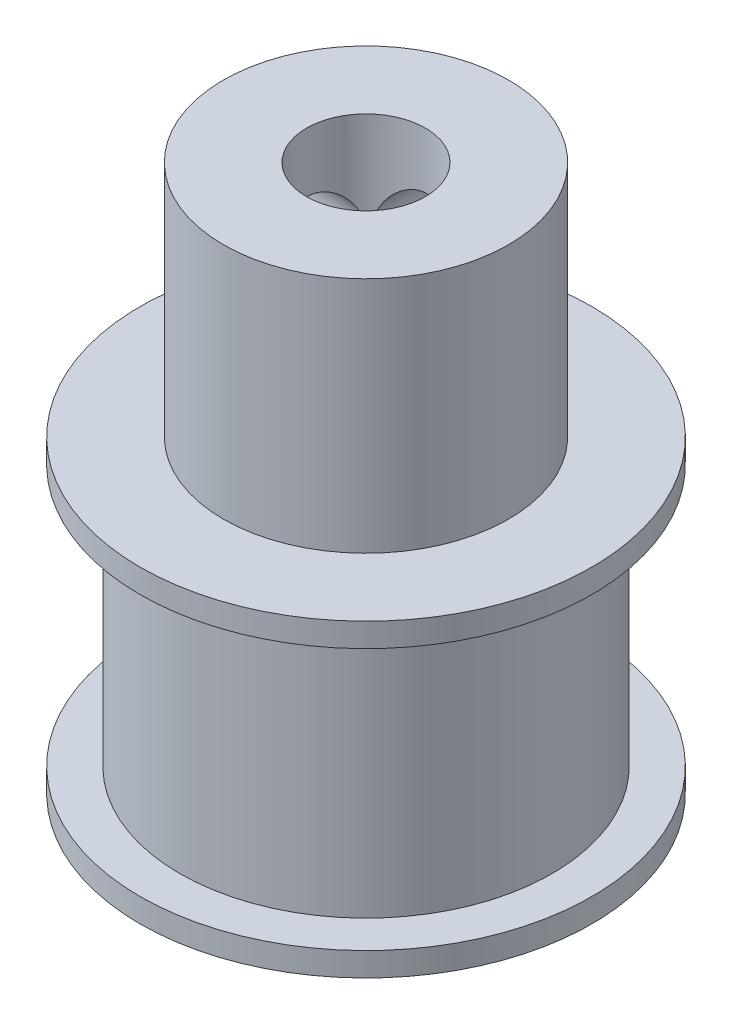
from build123d import *

# Parameters (mm, degrees)
SKETCH_1_R              = 9.5
EXTRUDE_1_DEPTH         = 1
SKETCH_2_R              = 7.83
EXTRUDE_2_DEPTH         = 11
SKETCH_3_R              = 9.5
EXTRUDE_3_DEPTH         = 1
SKETCH_4_R              = 6
EXTRUDE_4_DEPTH         = 10
SKETCH_5_R              = 2.5
CUT_EXTRUDE_1_DEPTH     = 27.636441204
HOLE_WIZARD_M4_1_REACH  = 28.281
HOLE_WIZARD_M4_1_BORE_R = 1.65
HOLE_WIZARD_M4_2_REACH  = 28.348
HOLE_WIZARD_M4_2_BORE_R = 1.65


with BuildPart() as part:
    # 草图1 → 凸台-拉伸1 (new body)
    with BuildSketch(Plane(origin=(0, 0, 0), x_dir=(1, 0, 0), z_dir=(0, 1, 0))):
        with Locations(Location((0, 0, 0), (0, 0, 270))):
            Circle(SKETCH_1_R)
    extrude(amount=EXTRUDE_1_DEPTH)

    # 草图2 → 凸台-拉伸2 (add)
    with BuildSketch(Plane(origin=(0, 1, 0), x_dir=(1, 0, 0), z_dir=(0, 1, 0))):
        with Locations(Location((0, 0, 0), (0, 0, 270))):
            Circle(SKETCH_2_R)
    extrude(amount=EXTRUDE_2_DEPTH)

    # 草图3 → 凸台-拉伸3 (add)
    with BuildSketch(Plane(origin=(0, 12, 0), x_dir=(1, 0, 0), z_dir=(0, 1, 0))):
        with Locations(Location((0, 0, 0), (0, 0, 270))):
            Circle(SKETCH_3_R)
    extrude(amount=EXTRUDE_3_DEPTH)

    # 草图4 → 凸台-拉伸4 (add)
    with BuildSketch(Plane(origin=(0, 13, 0), x_dir=(1, 0, 0), z_dir=(0, 1, 0))):
        with Locations(Location((0, 0, 0), (0, 0, 270))):
            Circle(SKETCH_4_R)
    extrude(amount=EXTRUDE_4_DEPTH)

    # 草图5 → 切除-拉伸1 (cut, through all)
    with BuildSketch(Plane(origin=(0, 23, 0), x_dir=(1, 0, 0), z_dir=(0, 1, 0))):
        with Locations(Location((0, 0, 0), (0, 0, 270))):
            Circle(SKETCH_5_R)
    extrude(amount=-CUT_EXTRUDE_1_DEPTH, mode=Mode.SUBTRACT)

    # M4 螺纹孔1 bore (on position points) → M4 螺纹孔1 (cut, up to next)
    with BuildSketch(Plane(origin=(-5.992739495, 18.833476166, -0.295081925), x_dir=(0.04918032089, 0, -0.998789915867), z_dir=(-0.998789915867, 0, -0.04918032089)), mode=Mode.PRIVATE) as hole_wizard_m4_1_sk1:
        Circle(HOLE_WIZARD_M4_1_BORE_R)
    hole_wizard_m4_1_tool1 = extrude(hole_wizard_m4_1_sk1.sketch, amount=-HOLE_WIZARD_M4_1_REACH, mode=Mode.PRIVATE) & part.part
    add(hole_wizard_m4_1_tool1.solids().sort_by_distance((-5.992739, 18.833476, -0.295082))[0], mode=Mode.SUBTRACT)

    # M4 螺纹孔2 bore (on position points) → M4 螺纹孔2 (cut, up to next)
    with BuildSketch(Plane(origin=(0.168248466, 18.988782442, -5.997640574), x_dir=(-0.999606762316, 0, -0.028041411034), z_dir=(0.028041411034, 0, -0.999606762316)), mode=Mode.PRIVATE) as hole_wizard_m4_2_sk1:
        Circle(HOLE_WIZARD_M4_2_BORE_R)
    hole_wizard_m4_2_tool1 = extrude(hole_wizard_m4_2_sk1.sketch, amount=-HOLE_WIZARD_M4_2_REACH, mode=Mode.PRIVATE) & part.part
    add(hole_wizard_m4_2_tool1.solids().sort_by_distance((0.168248, 18.988782, -5.997641))[0], mode=Mode.SUBTRACT)


solid = part.part
